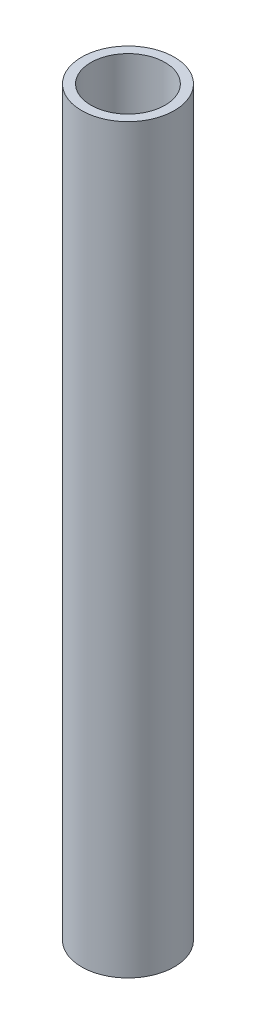
from build123d import *

# Parameters (mm, degrees)
SKETCH_1_R      = 2.5
SKETCH_1_R_2    = 2
EXTRUDE_1_DEPTH = 40


with BuildPart() as part:
    # 草图1 → 凸台-拉伸1 (new body)
    with BuildSketch(Plane(origin=(0, 0, 0), x_dir=(1, 0, 0), z_dir=(0, 1, 0))):
        with Locations(Location((0, 0, 0), (0, 0, 270))):
            Circle(SKETCH_1_R)
        with Locations(Location((0, 0, 0), (0, 0, 270))):
            Circle(SKETCH_1_R_2, mode=Mode.SUBTRACT)
    extrude(amount=EXTRUDE_1_DEPTH)


solid = part.part
